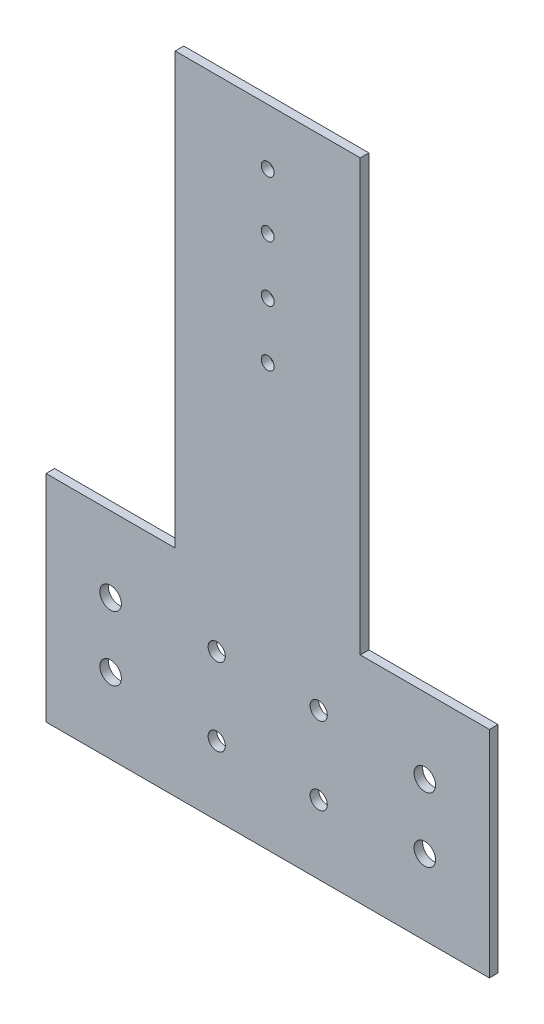
from build123d import *

# Parameters (mm, degrees)
SKETCH1_W           = 103
SKETCH1_H           = 50
BOSS_EXTRUDE1_DEPTH = 2
SKETCH3_R           = 2
CUT_EXTRUDE1_DEPTH  = 7
SKETCH4_R           = 2.5
CUT_EXTRUDE2_DEPTH  = 7
SKETCH6_W           = 43
SKETCH6_H           = 2
BOSS_EXTRUDE3_DEPTH = 100
SKETCH7_R           = 1.5
CUT_EXTRUDE3_DEPTH  = 30


with BuildPart() as part:
    # Sketch1 → Boss-Extrude1 (new body)
    with BuildSketch(Plane.XY):
        Rectangle(SKETCH1_W, SKETCH1_H)
    extrude(amount=BOSS_EXTRUDE1_DEPTH)

    # Sketch3 → Cut-Extrude1 (cut)
    with BuildSketch(Plane.XY.offset(2)):
        with Locations((-11.845, 9)):
            Circle(SKETCH3_R)
        with Locations((-11.845, -9)):
            Circle(SKETCH3_R)
        with Locations((11.845, -9)):
            Circle(SKETCH3_R)
        with Locations((11.845, 9)):
            Circle(SKETCH3_R)
    extrude(amount=-CUT_EXTRUDE1_DEPTH, mode=Mode.SUBTRACT)

    # Sketch4 → Cut-Extrude2 (cut)
    with BuildSketch(Plane.XY.offset(2)):
        with Locations((-36.5, 7.5)):
            Circle(SKETCH4_R)
        with Locations((-36.5, -7.5)):
            Circle(SKETCH4_R)
        with Locations(Location((36.5, -7.5, 0), (0, 0, 180))):
            Circle(SKETCH4_R)
        with Locations(Location((36.5, 7.5, 0), (0, 0, 180))):
            Circle(SKETCH4_R)
    extrude(amount=-CUT_EXTRUDE2_DEPTH, mode=Mode.SUBTRACT)

    # Sketch6 → Boss-Extrude3 (add)
    with BuildSketch(Plane(origin=(0, 25, 0), x_dir=(1, 0, 0), z_dir=(0, 1, 0))):
        with Locations((0, -1)):
            Rectangle(SKETCH6_W, SKETCH6_H)
    extrude(amount=BOSS_EXTRUDE3_DEPTH)

    # Sketch7 → Cut-Extrude3 (cut)
    with BuildSketch(Plane.XY.offset(2)):
        with Locations((0, 112)):
            Circle(SKETCH7_R)
        with Locations((0, 99)):
            Circle(SKETCH7_R)
        with Locations((0, 86)):
            Circle(SKETCH7_R)
        with Locations((0, 73)):
            Circle(SKETCH7_R)
    extrude(amount=-CUT_EXTRUDE3_DEPTH, mode=Mode.SUBTRACT)


solid = part.part
